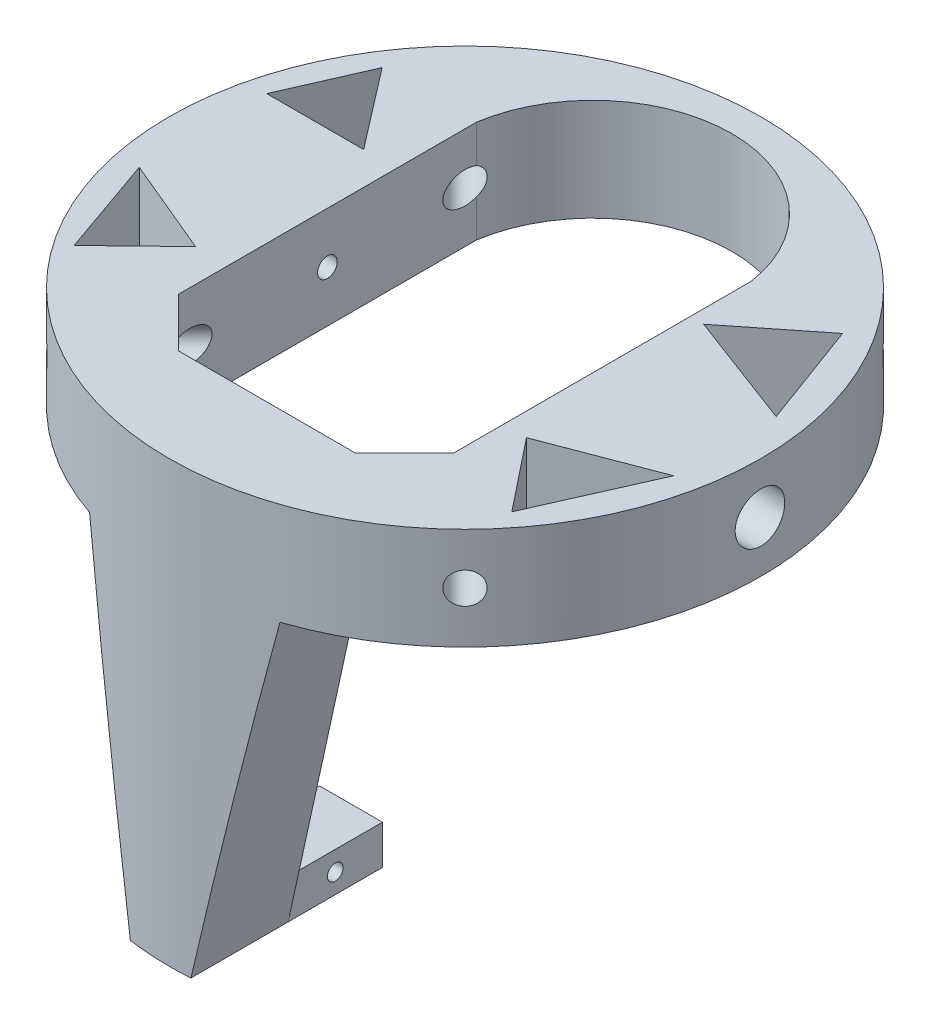
from build123d import *

# Parameters (mm, degrees)
BOSS_EXTRUDE1_DEPTH      = 13
SKETCH4_W                = 8
SKETCH4_H                = 2
BOSS_EXTRUDE2_DEPTH      = 43
SKETCH5_W                = 8
SKETCH5_H                = 5
BOSS_EXTRUDE3_DEPTH      = 12
SKETCH6_R                = 1
CUT_EXTRUDE3_DEPTH       = 13
FILLET1_R                = 10
BOSS_EXTRUDE4_DEPTH      = 2
SKETCH11_R               = 37.7
BOSS_EXTRUDE5_DEPTH      = 13
SKETCH22_R               = 1.25
CUT_EXTRUDE6_DEPTH       = 83
SKETCH22_3_R             = 3.155829002
SKETCH22_3_R_2           = 1.25
CUT_EXTRUDE7_DEPTH       = 15
SKETCH23_R               = 3
CUT_EXTRUDE8_DEPTH       = 15
BOSS_EXTRUDE6_REACH      = 133.524
BOSS_EXTRUDE6_END_RADIUS = 37.7
SKETCH26_R               = 2
CUT_EXTRUDE9_DEPTH       = 88
SKETCH27_R               = 2
CUT_EXTRUDE10_DEPTH      = 120
SKETCH28_W               = 5.884393281
SKETCH28_H               = 23.801066831
CUT_EXTRUDE11_DEPTH      = 2.5
CUT_EXTRUDE12_REACH      = 126.386


with BuildPart() as part:
    # Sketch2 → Boss-Extrude1 (new body)
    with BuildSketch(Plane(origin=(0, 0, 0), x_dir=(1, 0, 0), z_dir=(0, 1, 0))):
        Polygon((56.165444193, 16.052878064), (80.422298442, 16.052878064), (87.816410992, 8.658765514), (87.816410992, -30.998088735), (80.422298442, -38.392201285), (56.165444193, -38.392201285), (48.771331643, -30.998088735), (48.771331643, 8.658765514), align=None)
        Polygon((50.771331643, -30.16966161), (50.771331643, 7.83033839), (56.993871317, 14.052878064), (79.593871317, 14.052878064), (85.816410992, 7.83033839), (85.816410992, -30.16966161), (79.593871317, -36.392201285), (56.993871317, -36.392201285), align=None, mode=Mode.SUBTRACT)
    extrude(amount=BOSS_EXTRUDE1_DEPTH)

    # Sketch4 → Boss-Extrude2 (add)
    with BuildSketch(Plane.XZ):
        with Locations((66.993871317, 37.392201285)):
            Rectangle(SKETCH4_W, SKETCH4_H)
    extrude(amount=BOSS_EXTRUDE2_DEPTH)

    # Sketch5 → Boss-Extrude3 (add)
    with BuildSketch(Plane(origin=(0, 0, 36.392201285), x_dir=(-1, 0, 0), z_dir=(0, 0, -1))):
        with Locations((-66.993871317, -12.5)):
            Rectangle(SKETCH5_W, SKETCH5_H)
        with Locations((-66.993871317, -40.5)):
            Rectangle(SKETCH5_W, SKETCH5_H)
    extrude(amount=BOSS_EXTRUDE3_DEPTH)

    # Sketch6 → Cut-Extrude3 (cut)
    with BuildSketch(Plane.ZY.offset(-62.993871317)):
        with Locations((30.392201285, -12.5)):
            Circle(SKETCH6_R)
        with Locations((30.392201285, -40.5)):
            Circle(SKETCH6_R)
    extrude(amount=-CUT_EXTRUDE3_DEPTH, mode=Mode.SUBTRACT)

    # Fillet1
    fillet1_edges = [part.edges().sort_by_distance(p)[0] for p in [
        (66.993871317, -10, 36.392201285),
    ]]
    fillet(fillet1_edges, radius=FILLET1_R)

    # Sketch10 → Boss-Extrude4 (add)
    with BuildSketch(Plane.XY.offset(38.392201285)):
        Polygon((56.165444193, 0), (62.993871317, -43), (70.993871317, -43), (80.422298442, 0), align=None)
    extrude(amount=-BOSS_EXTRUDE4_DEPTH)

    # Sketch11 → Boss-Extrude5 (add)
    with BuildSketch(Plane(origin=(0, 13, 0), x_dir=(1, 0, 0), z_dir=(0, 1, 0))):
        with Locations(Location((68.293871317, -11.16966161, 0), (0, 0, 270))):
            Circle(SKETCH11_R)
        Polygon((56.165444193, 16.052878064), (48.771331643, 8.658765514), (48.771331643, -30.998088735), (56.165444193, -38.392201285), (80.422298442, -38.392201285), (87.816410992, -30.998088735), (87.816410992, 8.658765514), (80.422298442, 16.052878064), align=None, mode=Mode.SUBTRACT)
    extrude(amount=-BOSS_EXTRUDE5_DEPTH)

    # Sketch22 → Cut-Extrude6 (cut)
    with BuildSketch(Plane(origin=(105.993871317, 0, 0), x_dir=(0, 0, -1), z_dir=(1, 0, 0))):
        with Locations((-11.16966161, 6.5)):
            Circle(SKETCH22_R)
    extrude(amount=-CUT_EXTRUDE6_DEPTH, mode=Mode.SUBTRACT)

    # Sketch22<3> → Cut-Extrude7 (cut)
    with BuildSketch(Plane(origin=(105.993871317, 0, 0), x_dir=(0, 0, -1), z_dir=(1, 0, 0))):
        with Locations((-11.16966161, 6.5)):
            Circle(SKETCH22_3_R)
        with Locations((-11.16966161, 6.5)):
            Circle(SKETCH22_3_R_2, mode=Mode.SUBTRACT)
    extrude(amount=-CUT_EXTRUDE7_DEPTH, mode=Mode.SUBTRACT)

    # Sketch23 → Cut-Extrude8 (cut)
    with BuildSketch(Plane.ZY.offset(-30.593871317)):
        with Locations((11.16966161, 6.5)):
            Circle(SKETCH23_R)
    extrude(amount=-CUT_EXTRUDE8_DEPTH, mode=Mode.SUBTRACT)

    # Boss-Extrude6: up to this cylinder (the profile starts inside it)
    boss_extrude6_end = Plane(origin=(68.293871317, -17.888133, 11.16966161), z_dir=(0, 1, 0)) * Cylinder(BOSS_EXTRUDE6_END_RADIUS, 343.448, mode=Mode.PRIVATE)
    # Sketch25 → Boss-Extrude6 (add, up to the surface)
    with BuildSketch(Plane.XY.offset(38.392201285), mode=Mode.PRIVATE) as boss_extrude6_sk1:
        Polygon((80.422298442, 0), (56.165444193, 0), (62.993871317, -43), (70.993871317, -43), align=None)
    boss_extrude6_tool1 = extrude(boss_extrude6_sk1.sketch, amount=BOSS_EXTRUDE6_REACH, mode=Mode.PRIVATE) & boss_extrude6_end
    add(boss_extrude6_tool1.solids().sort_by_distance((67.753067, -17.888133, 38.392201))[0])

    # Sketch26 → Cut-Extrude9 (cut)
    with BuildSketch(Plane(origin=(1.904179203, 0, -1.904179203), x_dir=(0.7071067811865485, 0, 0.7071067811865467), z_dir=(-0.7071067811865467, 0, 0.7071067811865485))):
        with Locations((56.18920299, 6.5)):
            Circle(SKETCH26_R)
    extrude(amount=-CUT_EXTRUDE9_DEPTH, mode=Mode.SUBTRACT)

    # Sketch27 → Cut-Extrude10 (cut)
    with BuildSketch(Plane(origin=(66.389692115, 0, 66.389692115), x_dir=(0.7071067811865477, 0, -0.7071067811865474), z_dir=(0.7071067811865474, 0, 0.7071067811865477))):
        with Locations((40.392916054, 6.5)):
            Circle(SKETCH27_R)
    extrude(amount=-CUT_EXTRUDE10_DEPTH, mode=Mode.SUBTRACT)

    # Sketch28 → Cut-Extrude11 (cut)
    with BuildSketch(Plane.XZ):
        with Locations((88.758607633, 11.900533415)):
            Rectangle(SKETCH28_W, SKETCH28_H)
    extrude(amount=-CUT_EXTRUDE11_DEPTH, mode=Mode.SUBTRACT)

    # Sketch30 → Cut-Extrude12 (cut, up to next)
    with BuildSketch(Plane.XZ, mode=Mode.PRIVATE) as cut_extrude12_sk1:
        with BuildLine():
            Line((50.771331643, -7.83033839), (85.816410992, -7.83033839))
            ThreePointArc((85.816410992, -7.83033839), (68.293871317, -22.826628819), (50.771331643, -7.83033839))
        make_face()
    cut_extrude12_tool1 = extrude(cut_extrude12_sk1.sketch, amount=-CUT_EXTRUDE12_REACH, mode=Mode.PRIVATE) & part.part
    # Sketch30 → Cut-Extrude12 (cut, up to next)
    with BuildSketch(Plane.XZ, mode=Mode.PRIVATE) as cut_extrude12_sk2:
        Polygon((38.741691169, -7.83033839), (34.266383325, 2.385887147), (46.597716142, 2.385887147), align=None)
    cut_extrude12_tool2 = extrude(cut_extrude12_sk2.sketch, amount=-CUT_EXTRUDE12_REACH, mode=Mode.PRIVATE) & part.part
    # Sketch30 → Cut-Extrude12 (cut, up to next)
    with BuildSketch(Plane.XZ, mode=Mode.PRIVATE) as cut_extrude12_sk3:
        Polygon((97.389775461, -7.83033839), (87.532944471, 0), (102.33223512, 5.578425036), align=None)
    cut_extrude12_tool3 = extrude(cut_extrude12_sk3.sketch, amount=-CUT_EXTRUDE12_REACH, mode=Mode.PRIVATE) & part.part
    # Sketch30 → Cut-Extrude12 (cut, up to next)
    with BuildSketch(Plane.XZ, mode=Mode.PRIVATE) as cut_extrude12_sk4:
        Polygon((102.33223512, 18.629349006), (88.758607633, 23.801066831), (95.998995796, 32.915268399), align=None)
    cut_extrude12_tool4 = extrude(cut_extrude12_sk4.sketch, amount=-CUT_EXTRUDE12_REACH, mode=Mode.PRIVATE) & part.part
    # Sketch30 → Cut-Extrude12 (cut, up to next)
    with BuildSketch(Plane.XZ, mode=Mode.PRIVATE) as cut_extrude12_sk5:
        Polygon((34.266383325, 18.629349006), (38.741691169, 31.410722253), (46.597716142, 23.801066831), align=None)
    cut_extrude12_tool5 = extrude(cut_extrude12_sk5.sketch, amount=-CUT_EXTRUDE12_REACH, mode=Mode.PRIVATE) & part.part
    add(cut_extrude12_tool1.solids().sort_by_distance((68.293871, 0, -14.118791))[0], mode=Mode.SUBTRACT)
    add(cut_extrude12_tool2.solids().sort_by_distance((39.868597, 0, -1.019521))[0], mode=Mode.SUBTRACT)
    add(cut_extrude12_tool3.solids().sort_by_distance((95.751652, 0, -0.750638))[0], mode=Mode.SUBTRACT)
    add(cut_extrude12_tool4.solids().sort_by_distance((95.696613, 0, 25.115228))[0], mode=Mode.SUBTRACT)
    add(cut_extrude12_tool5.solids().sort_by_distance((39.868597, 0, 24.613713))[0], mode=Mode.SUBTRACT)


solid = part.part
